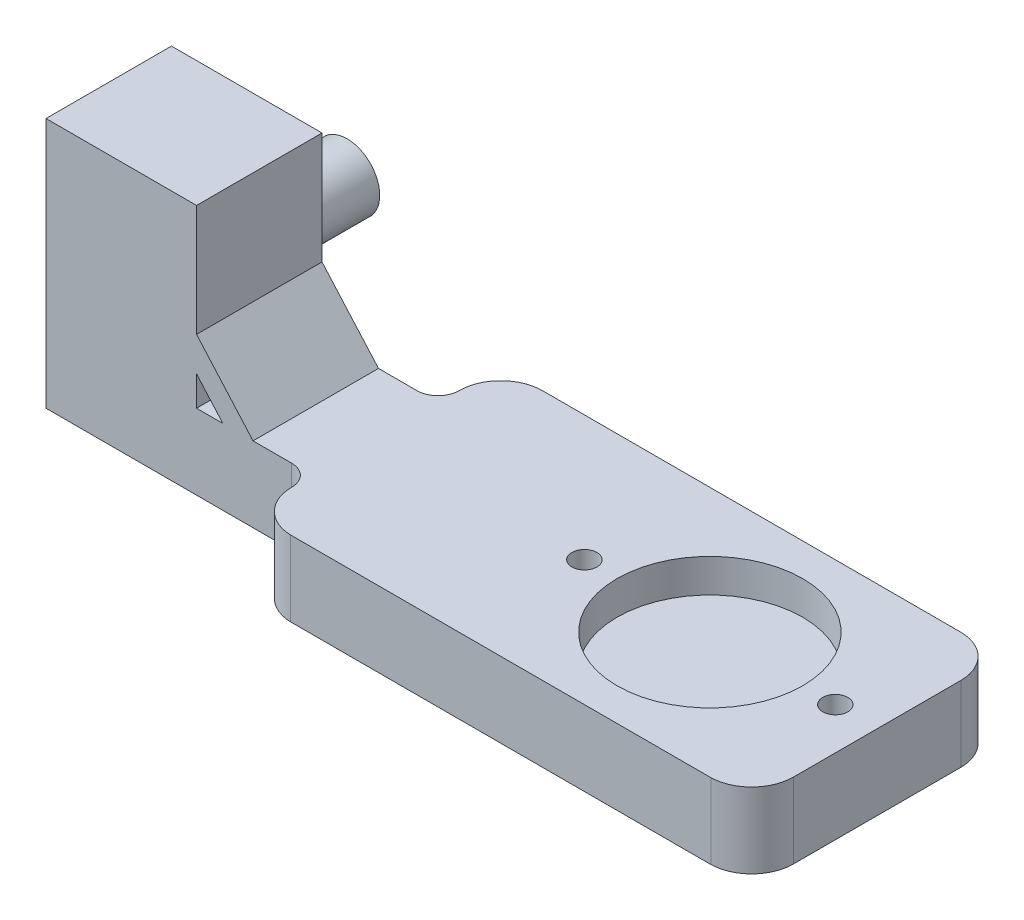
from build123d import *

# Parameters (mm, degrees)
BOSS_EXTRUDE1_DEPTH = 9
SKETCH3_R           = 11.1
SKETCH3_R_2         = 1.5
CUT_EXTRUDE1_DEPTH  = 4
BOSS_EXTRUDE2_DEPTH = 30
BOSS_EXTRUDE4_DEPTH = 15
SKETCH7_R           = 3.9
BOSS_EXTRUDE5_DEPTH = 12


with BuildPart() as part:
    # Sketch1 → Boss-Extrude1 (new body)
    with BuildSketch(Plane(origin=(0, 0, 0), x_dir=(1, 0, 0), z_dir=(0, 1, 0))):
        with BuildLine():
            Line((-25, 11.350947881), (25, 11.350947881))
            ThreePointArc((25, 11.350947881), (28.535533906, 9.886481787), (30, 6.350947881))
            Line((30, 6.350947881), (30, -13.650519031))
            ThreePointArc((30, -13.650519031), (28.578095606, -17.142972586), (25.121107266, -18.649052119))
            Line((25.121107266, -18.649052119), (-25.121107266, -18.649052119))
            ThreePointArc((-25.121107266, -18.649052119), (-28.578095606, -17.142972586), (-30, -13.650519031))
            ThreePointArc((-30, -13.650519031), (-30.731714061, -11.881803874), (-32.49999957, -11.149052119))
            Line((-32.49999957, -11.149052119), (-43.869213178, -11.149052119))
            Line((-43.869213178, -11.149052119), (-43.869213178, 3.850947881))
            Line((-43.869213178, 3.850947881), (-32.5, 3.850947881))
            ThreePointArc((-32.5, 3.850947881), (-30.732233047, 4.583180928), (-30, 6.350947881))
            ThreePointArc((-30, 6.350947881), (-28.535533906, 9.886481787), (-25, 11.350947881))
        make_face()
    extrude(amount=BOSS_EXTRUDE1_DEPTH)

    # Sketch3 → Cut-Extrude1 (cut)
    with BuildSketch(Plane(origin=(0, 9, 0), x_dir=(1, 0, 0), z_dir=(0, 1, 0))):
        with Locations(Location((10, -3.649785575, 0), (0, 0, 270))):
            Circle(SKETCH3_R)
        with Locations(Location((-5, -3.649785575, 0), (0, 0, 270))):
            Circle(SKETCH3_R_2)
        with Locations(Location((25, -3.649785575, 0), (0, 0, 270))):
            Circle(SKETCH3_R_2)
    extrude(amount=-CUT_EXTRUDE1_DEPTH, mode=Mode.SUBTRACT)

    # Sketch2 → Boss-Extrude2 (add)
    with BuildSketch(Plane(origin=(0, 0, 0), x_dir=(1, 0, 0), z_dir=(0, 1, 0))):
        Polygon((-59.869213178, -11.149052119), (-45.869213178, -11.149052119), (-43.869213178, -11.149052119), (-43.869213178, -9.149052119), (-43.869213178, -4.149052119), (-43.869213178, 3.850947881), (-45.869213178, 3.850947881), (-59.869213178, 3.850947881), (-61.869213178, 3.850947881), (-61.869213178, -9.149052119), (-61.869213178, -11.149052119), align=None)
    extrude(amount=BOSS_EXTRUDE2_DEPTH)

    # Sketch6 → Boss-Extrude4 (add)
    with BuildSketch(Plane.XY.offset(11.149052119)):
        Polygon((-43.869213178, 12.558501201), (-40.727008234, 9), (-37.115574999, 9), (-43.869213178, 16.648396589), align=None)
    extrude(amount=-BOSS_EXTRUDE4_DEPTH)

    # Sketch7 → Boss-Extrude5 (add)
    with BuildSketch(Plane(origin=(0, 0, -3.850947881), x_dir=(-1, 0, 0), z_dir=(0, 0, -1))):
        with Locations(Location((52.869213178, 15, 0), (0, 0, 180))):
            Circle(SKETCH7_R)
    extrude(amount=BOSS_EXTRUDE5_DEPTH)


solid = part.part
